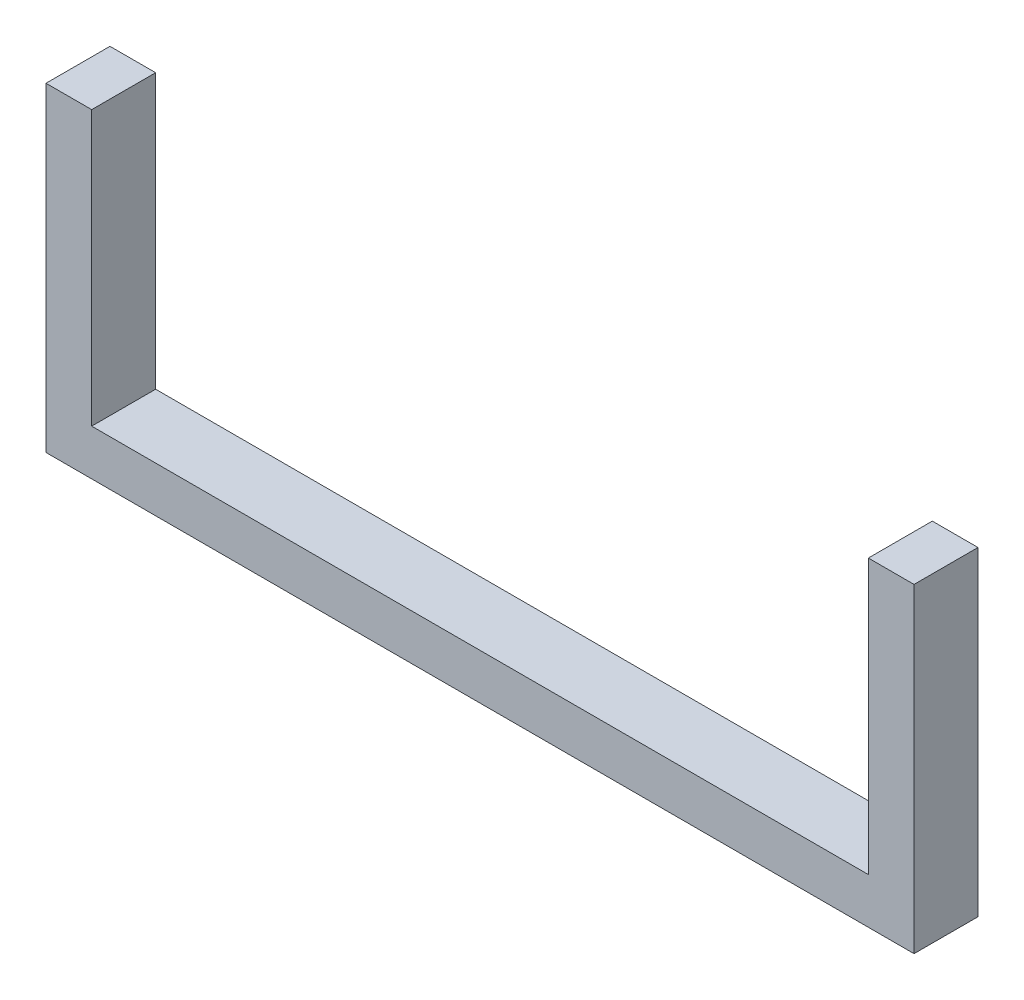
from build123d import *

# Parameters (mm, degrees)
SKETCH1_W           = 190
SKETCH1_H           = 14
BOSS_EXTRUDE1_DEPTH = 10
SKETCH2_W           = 10
SKETCH2_H           = 14
BOSS_EXTRUDE2_DEPTH = 60


with BuildPart() as part:
    # Sketch1 → Boss-Extrude1 (new body)
    with BuildSketch(Plane(origin=(0, 0, 0), x_dir=(1, 0, 0), z_dir=(0, 1, 0))):
        with Locations((95, 7)):
            Rectangle(SKETCH1_W, SKETCH1_H)
    extrude(amount=BOSS_EXTRUDE1_DEPTH)

    # Sketch2 → Boss-Extrude2 (add)
    with BuildSketch(Plane(origin=(0, 10, 0), x_dir=(1, 0, 0), z_dir=(0, 1, 0))):
        with Locations((5, 7)):
            Rectangle(SKETCH2_W, SKETCH2_H)
        with Locations((185, 7)):
            Rectangle(SKETCH2_W, SKETCH2_H)
    extrude(amount=BOSS_EXTRUDE2_DEPTH)


solid = part.part
